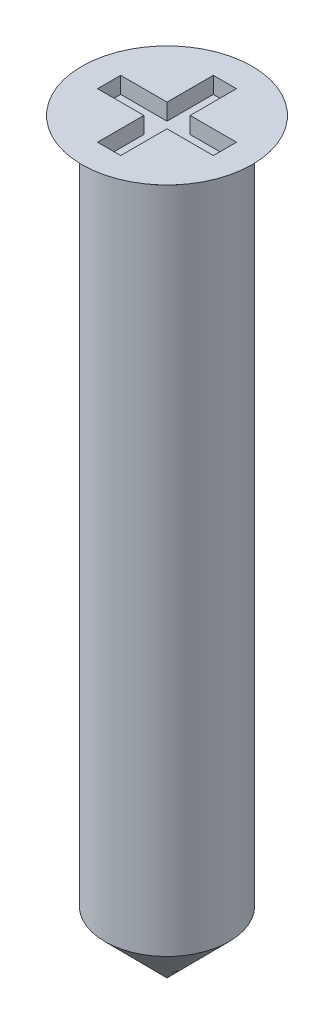
from build123d import *

# Parameters (mm, degrees)
CUT_EXTRUDE1_DEPTH = 0.2


with BuildPart() as part:
    # Sketch1 → Revolve1 (revolve)
    with BuildSketch(Plane.XY, mode=Mode.PRIVATE) as revolve1_sk:
        Polygon((0, 0), (0.75, 0.755428016), (0.75, 8.83), (1.03, 9.03), (0, 9.03), align=None)
    revolve(revolve1_sk.sketch.rotate(Axis((0, 12.912548638, 0), (0, -1, 0)), 90), axis=Axis((0, 12.912548638, 0), (0, -1, 0)))

    # Sketch2 → Cut-Extrude1 (cut)
    with BuildSketch(Plane(origin=(0, 9.03, 0), x_dir=(1, 0, 0), z_dir=(0, 1, 0))):
        Polygon((-0.14, 0.14), (-0.14, 0.7), (0.14, 0.7), (0.14, 0.14), (0.7, 0.14), (0.7, -0.14), (0.14, -0.14), (0.14, -0.7), (-0.14, -0.7), (-0.14, -0.14), (-0.7, -0.14), (-0.7, 0.14), align=None)
    extrude(amount=-CUT_EXTRUDE1_DEPTH, mode=Mode.SUBTRACT)


solid = part.part
